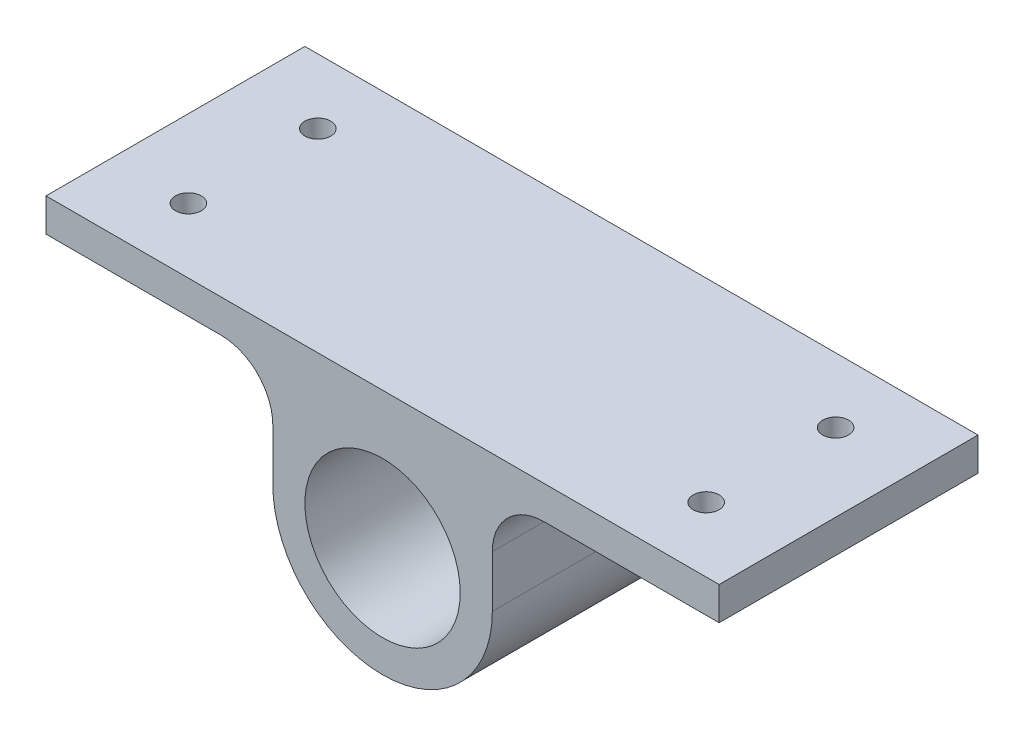
from build123d import *

# Parameters (mm, degrees)
SKETCH1_R           = 75
BOSS_EXTRUDE1_DEPTH = 125
SKETCH2_R           = 12.5
CUT_EXTRUDE1_DEPTH  = 422.774821439


with BuildPart() as part:
    # Sketch1 → Boss-Extrude1 (new, symmetric)
    with BuildSketch(Plane.XY):
        with BuildLine():
            Line((-106, 0), (-106, 50))
            ThreePointArc((-106, 50), (-120.644660941, 85.355339059), (-156, 100))
            Line((-156, 100), (-325, 100))
            Line((-325, 100), (-325, 132))
            Line((-325, 132), (325, 132))
            Line((325, 132), (325, 100))
            Line((325, 100), (156, 100))
            ThreePointArc((156, 100), (120.644660941, 85.355339059), (106, 50))
            Line((106, 50), (106, 0))
            ThreePointArc((106, 0), (0, -106), (-106, 0))
        make_face()
        Circle(SKETCH1_R, mode=Mode.SUBTRACT)
    extrude(amount=BOSS_EXTRUDE1_DEPTH, both=True)

    # Sketch2 → Cut-Extrude1 (cut, through all)
    with BuildSketch(Plane(origin=(0, 132, 0), x_dir=(1, 0, 0), z_dir=(0, 1, 0))):
        with Locations(Location((-250, 62.5, 0), (0, 0, 180))):
            Circle(SKETCH2_R)
        with Locations(Location((250, 62.5, 0), (0, 0, 270))):
            Circle(SKETCH2_R)
        with Locations(Location((250, -62.5, 0), (0, 0, 180))):
            Circle(SKETCH2_R)
        with Locations(Location((-250, -62.5, 0), (0, 0, 180))):
            Circle(SKETCH2_R)
    extrude(amount=-CUT_EXTRUDE1_DEPTH, mode=Mode.SUBTRACT)


solid = part.part
